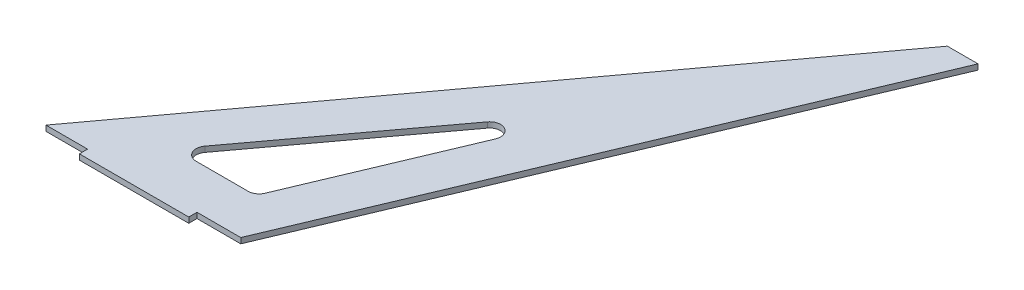
from build123d import *

# Parameters (mm, degrees)
BOSS_EXTRUDE1_DEPTH = 3.175
CUT_EXTRUDE1_DEPTH  = 3.175
FILLET1_R           = 6.35
SKETCH3_W           = 63.5
SKETCH3_H           = 3.175
BOSS_EXTRUDE2_DEPTH = 4.7625
CUT_EXTRUDE2_DEPTH  = 386.753713985


with BuildPart() as part:
    # Sketch1 → Boss-Extrude1 (new body)
    with BuildSketch(Plane(origin=(0, 0, 0), x_dir=(1, 0, 0), z_dir=(0, 1, 0))):
        Polygon((0, 301.244), (-17.78, 301.244), (-240.931317375, 0), (-126.631317375, 0), align=None)
    extrude(amount=BOSS_EXTRUDE1_DEPTH)

    # Sketch2 → Cut-Extrude1 (cut)
    with BuildSketch(Plane(origin=(0, 3.175, 0), x_dir=(1, 0, 0), z_dir=(0, 1, 0))):
        Polygon((-143.507037027, 25.4), (-81.84578186, 172.086329549), (-190.506029632, 25.4), align=None)
    extrude(amount=-CUT_EXTRUDE1_DEPTH, mode=Mode.SUBTRACT)

    # Fillet1
    fillet1_edges = [part.edges().sort_by_distance(p)[0] for p in [
        (-143.507037027, 1.5875, -25.4),
        (-190.506029632, 1.5875, -25.4),
        (-81.84578186, 1.5875, -172.086329549),
    ]]
    fillet(fillet1_edges, radius=FILLET1_R)

    # Sketch3 → Boss-Extrude2 (add)
    with BuildSketch(Plane.XY):
        with Locations((-183.781317375, 1.5875)):
            Rectangle(SKETCH3_W, SKETCH3_H)
    extrude(amount=BOSS_EXTRUDE2_DEPTH)

    # Sketch4 → Cut-Extrude2 (cut, through all)
    with BuildSketch(Plane(origin=(0, 3.175, 0), x_dir=(1, 0, 0), z_dir=(0, 1, 0))):
        Polygon((-17.78, 301.244), (-239.661317375, 0), (-240.931317375, 0), align=None)
    extrude(amount=-CUT_EXTRUDE2_DEPTH, mode=Mode.SUBTRACT)


solid = part.part
